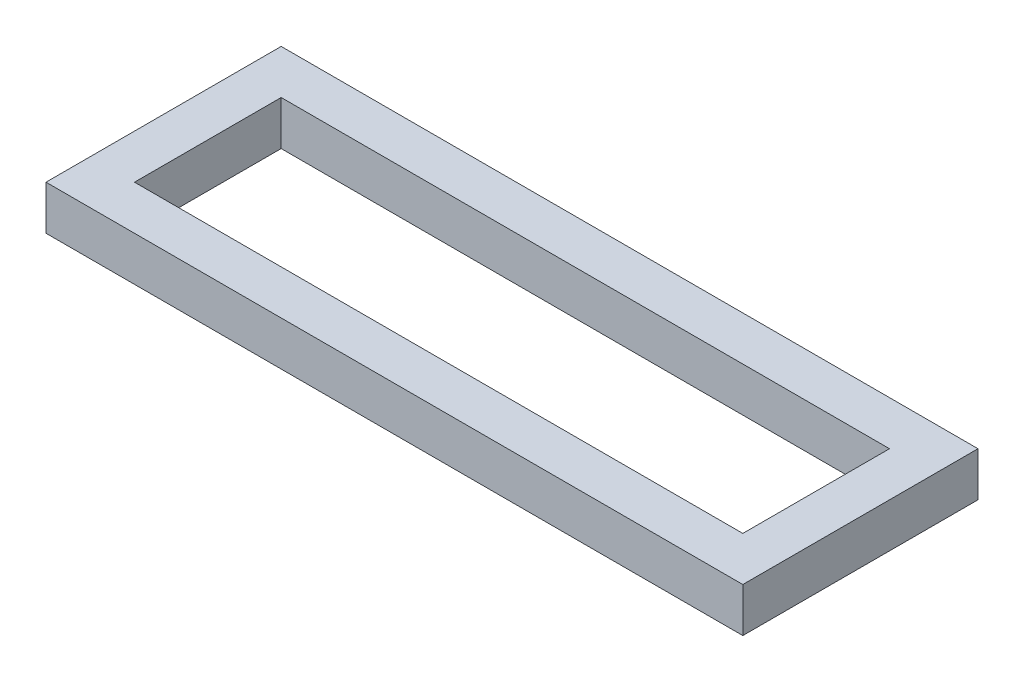
from build123d import *

# Parameters (mm, degrees)
SKETCH1_W           = 400
SKETCH1_H           = 135
SKETCH1_W_2         = 349.2
SKETCH1_H_2         = 84.2
BOSS_EXTRUDE1_DEPTH = 25.4


with BuildPart() as part:
    # Sketch1 → Boss-Extrude1 (new body)
    with BuildSketch(Plane(origin=(0, 0, 0), x_dir=(1, 0, 0), z_dir=(0, 1, 0))):
        Rectangle(SKETCH1_W, SKETCH1_H)
        Rectangle(SKETCH1_W_2, SKETCH1_H_2, mode=Mode.SUBTRACT)
    extrude(amount=BOSS_EXTRUDE1_DEPTH)


solid = part.part
